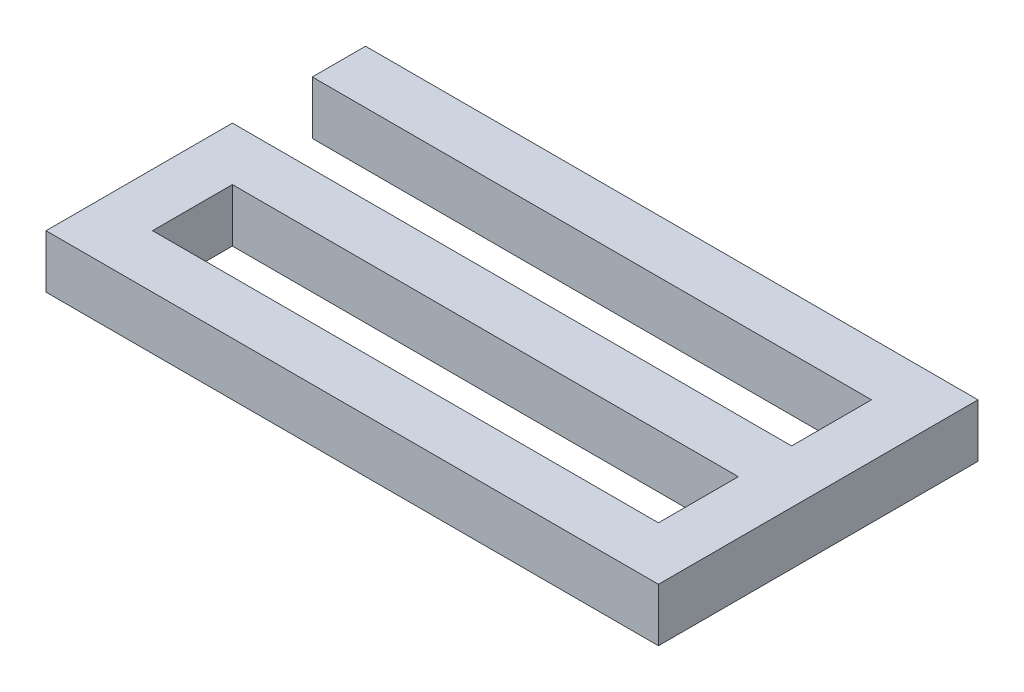
from build123d import *

# Parameters (mm, degrees)
ESBO_O1_W                = 19
ESBO_O1_H                = 3
RESSALTO_EXTRUS_O1_DEPTH = 2


with BuildPart() as part:
    # Esboço1 → Ressalto-extrusão1 (new body)
    with BuildSketch(Plane(origin=(0, 0, 0), x_dir=(1, 0, 0), z_dir=(0, 1, 0))):
        Polygon((-10.479474548, 11.375), (12.520525452, 11.375), (12.520525452, -0.625), (10.520525452, -0.625), (-10.479474548, -0.625), (-10.479474548, 6.375), (10.520525452, 6.375), (10.520525452, 9.375), (-10.479474548, 9.375), align=None)
        with Locations((1.020525452, 2.875)):
            Rectangle(ESBO_O1_W, ESBO_O1_H, mode=Mode.SUBTRACT)
    extrude(amount=RESSALTO_EXTRUS_O1_DEPTH)


solid = part.part
